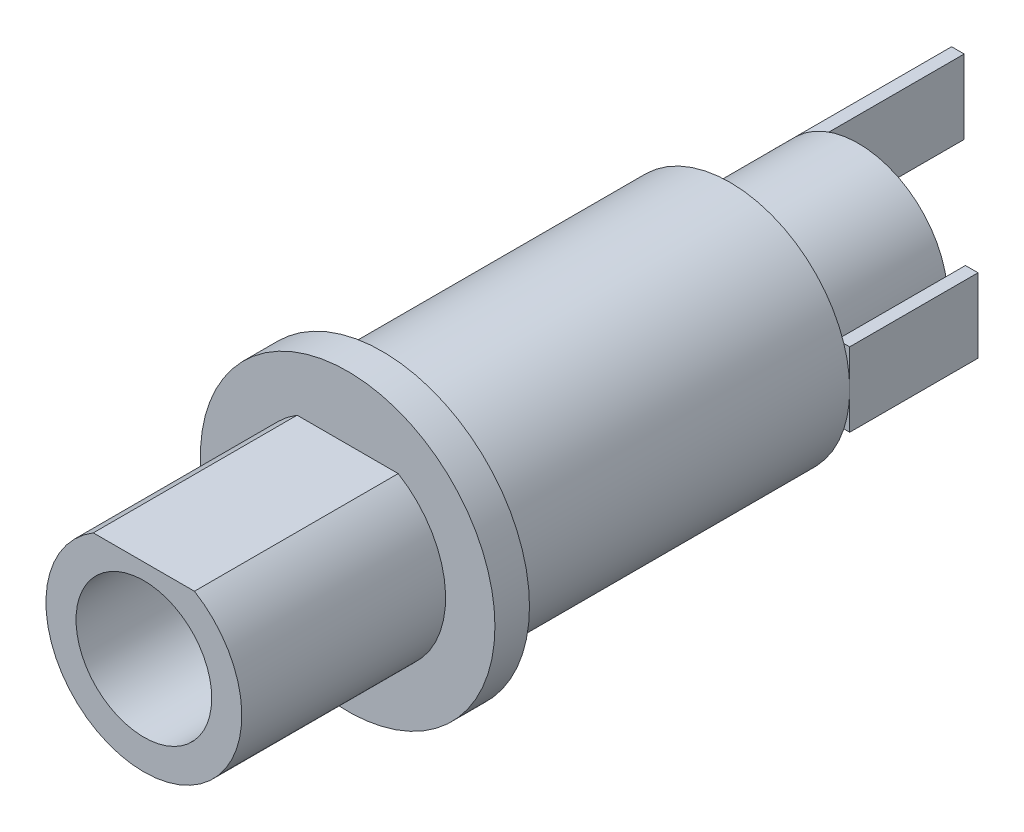
from build123d import *

# Parameters (mm, degrees)
ESQUISSE1_R                              = 5.97
BOSS_EXTRU_1_DEPTH                       = 1.4
ESQUISSE2_R                              = 4.85
BOSS_EXTRU_2_DEPTH                       = 14.1
ESQUISSE3_R                              = 3.97
ESQUISSE3_R_2                            = 2.75
BOSS_EXTRU_3_DEPTH                       = 8.26
ESQUISSE4_R                              = 1
BOSS_EXTRU_4_DEPTH                       = 5
ENL_V_MAT_EXTRU_1_REACH                  = 18.434
ENL_V_MAT_EXTRU_1_END_RADIUS             = 3.97
ESQUISSE5_W                              = 8.26
ESQUISSE5_H                              = 0.57
ENL_V_MAT_EXTRU_1_DIRECTION_2_REACH      = 18.434
ENL_V_MAT_EXTRU_1_DIRECTION_2_END_RADIUS = 3.97
ESQUISSE6_R                              = 3.62
ESQUISSE6_W                              = 0.51
ESQUISSE6_H                              = 3
BOSS_EXTRU_5_DEPTH                       = 5.2
ESQUISSE7_W                              = 0.51
ESQUISSE7_H                              = 3
BOSS_EXTRU_6_DEPTH                       = 7.4


with BuildPart() as part:
    # Esquisse1 → Boss.-Extru.1 (new body)
    with BuildSketch(Plane.XY):
        Circle(ESQUISSE1_R)
    extrude(amount=BOSS_EXTRU_1_DEPTH)

    # Esquisse2 → Boss.-Extru.2 (add)
    with BuildSketch(Plane(origin=(0, 0, 0), x_dir=(-1, 0, 0), z_dir=(0, 0, -1))):
        Circle(ESQUISSE2_R)
    extrude(amount=BOSS_EXTRU_2_DEPTH)

    # Esquisse3 → Boss.-Extru.3 (add)
    with BuildSketch(Plane.XY.offset(1.4)):
        Circle(ESQUISSE3_R)
        Circle(ESQUISSE3_R_2, mode=Mode.SUBTRACT)
    extrude(amount=BOSS_EXTRU_3_DEPTH)

    # Esquisse4 → Boss.-Extru.4 (add)
    with BuildSketch(Plane.XY.offset(1.4)):
        Circle(ESQUISSE4_R)
    extrude(amount=BOSS_EXTRU_4_DEPTH)

    # Enlèv. mat.-Extru.1: up to this cylinder (the profile starts inside it)
    enl_v_mat_extru_1_end = Plane(origin=(0, 0, 5.53), z_dir=(0, 0, -1)) * Cylinder(ENL_V_MAT_EXTRU_1_END_RADIUS, 45.808, mode=Mode.PRIVATE)
    # Esquisse5 → Enlèv. mat.-Extru.1 (cut, up to the surface)
    with BuildSketch(Plane(origin=(0, 0, 0), x_dir=(0, 0, -1), z_dir=(1, 0, 0)), mode=Mode.PRIVATE) as enl_v_mat_extru_1_sk1:
        with Locations((-5.53, 3.685)):
            Rectangle(ESQUISSE5_W, ESQUISSE5_H)
    enl_v_mat_extru_1_tool1 = extrude(enl_v_mat_extru_1_sk1.sketch, amount=-ENL_V_MAT_EXTRU_1_REACH, mode=Mode.PRIVATE) & enl_v_mat_extru_1_end
    add(enl_v_mat_extru_1_tool1.solids().sort_by_distance((0, 3.685, 5.53))[0], mode=Mode.SUBTRACT)

    # Enlèv. mat.-Extru.1 direction 2: up to this cylinder (the profile starts inside it)
    enl_v_mat_extru_1_direction_2_end = Plane(origin=(0, 0, 5.53), z_dir=(0, 0, -1)) * Cylinder(ENL_V_MAT_EXTRU_1_DIRECTION_2_END_RADIUS, 45.808, mode=Mode.PRIVATE)
    # Esquisse5 → Enlèv. mat.-Extru.1 direction 2 (cut, up to the surface)
    with BuildSketch(Plane(origin=(0, 0, 0), x_dir=(0, 0, -1), z_dir=(1, 0, 0)), mode=Mode.PRIVATE) as enl_v_mat_extru_1_direction_2_sk1:
        with Locations((-5.53, 3.685)):
            Rectangle(ESQUISSE5_W, ESQUISSE5_H)
    enl_v_mat_extru_1_direction_2_tool1 = extrude(enl_v_mat_extru_1_direction_2_sk1.sketch, amount=ENL_V_MAT_EXTRU_1_DIRECTION_2_REACH, mode=Mode.PRIVATE) & enl_v_mat_extru_1_direction_2_end
    add(enl_v_mat_extru_1_direction_2_tool1.solids().sort_by_distance((0, 3.685, 5.53))[0], mode=Mode.SUBTRACT)

    # Esquisse6 → Boss.-Extru.5 (add)
    with BuildSketch(Plane(origin=(0, 0, -14.1), x_dir=(-1, 0, 0), z_dir=(0, 0, -1))):
        Circle(ESQUISSE6_R)
        with Locations((-4.595, 0)):
            Rectangle(ESQUISSE6_W, ESQUISSE6_H)
    extrude(amount=BOSS_EXTRU_5_DEPTH)

    # Esquisse7 → Boss.-Extru.6 (add)
    with BuildSketch(Plane(origin=(0, 0, -19.3), x_dir=(-1, 0, 0), z_dir=(0, 0, -1))):
        with Locations((3.365, 0)):
            Rectangle(ESQUISSE7_W, ESQUISSE7_H)
    extrude(amount=BOSS_EXTRU_6_DEPTH)


solid = part.part
